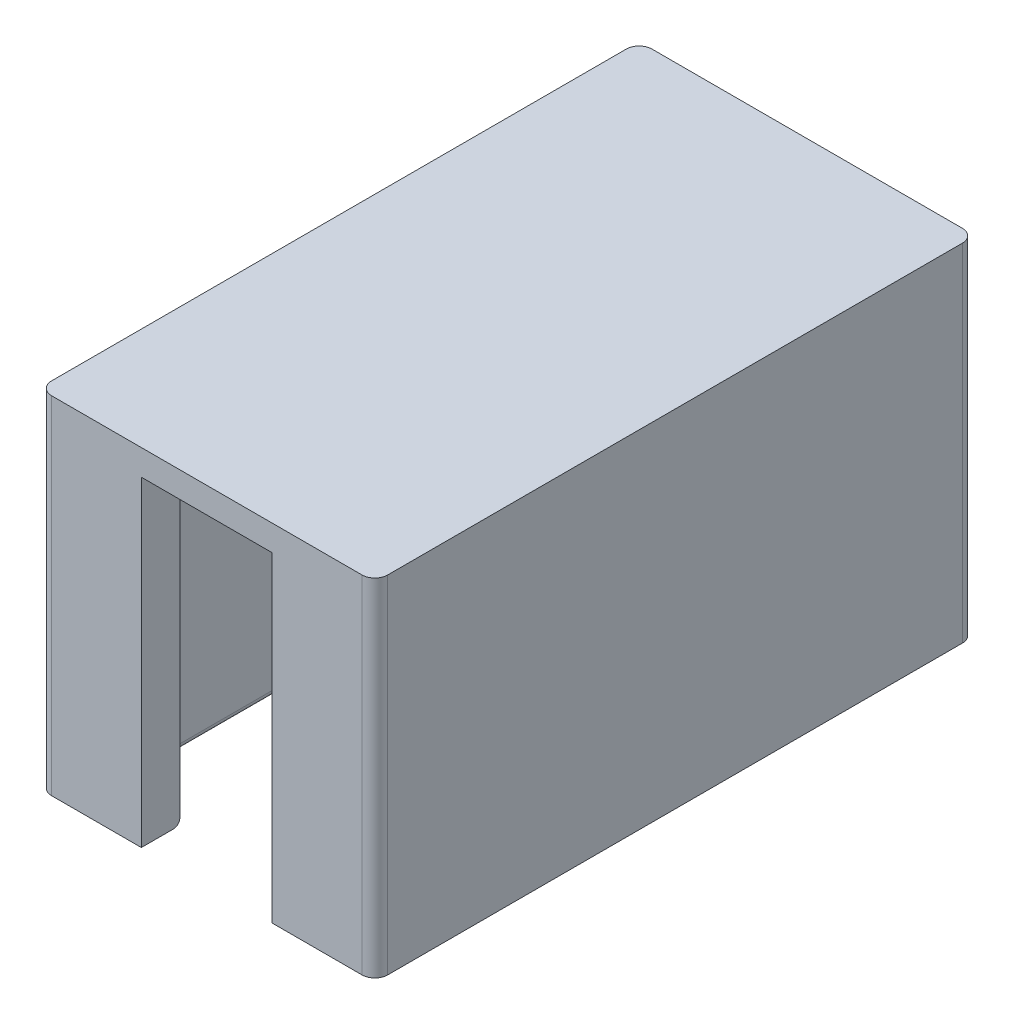
from build123d import *

# Parameters (mm, degrees)
SKETCH1_W           = 26.2
SKETCH1_H           = 46.8
SKETCH1_W_2         = 20.2
SKETCH1_H_2         = 40.8
BOSS_EXTRUDE1_DEPTH = 25
SKETCH3_W           = 10.2
SKETCH3_H           = 25
CUT_EXTRUDE1_DEPTH  = 10
FILLET1_R           = 0.5
SKETCH4_W           = 26.2
SKETCH4_H           = 46.8
BOSS_EXTRUDE2_DEPTH = 2
FILLET2_R           = 1


with BuildPart() as part:
    # Sketch1 → Boss-Extrude1 (new body)
    with BuildSketch(Plane(origin=(0, 0, 0), x_dir=(1, 0, 0), z_dir=(0, 1, 0))):
        with Locations((13.1, 23.4)):
            Rectangle(SKETCH1_W, SKETCH1_H)
        with Locations((13.1, 23.4)):
            Rectangle(SKETCH1_W_2, SKETCH1_H_2, mode=Mode.SUBTRACT)
    extrude(amount=BOSS_EXTRUDE1_DEPTH)

    # Sketch3 → Cut-Extrude1 (cut)
    with BuildSketch(Plane.XY):
        with Locations((13.1, 12.5)):
            Rectangle(SKETCH3_W, SKETCH3_H)
    extrude(amount=-CUT_EXTRUDE1_DEPTH, mode=Mode.SUBTRACT)

    # Fillet1
    fillet1_edges = [part.edges().sort_by_distance(p)[0] for p in [
        (3, 0, -23.4),
        (5.5, 0, -3),
        (23.2, 0, -23.4),
        (13.1, 0, -43.8),
        (3, 25, -23.4),
        (5.5, 25, -3),
        (23.2, 25, -23.4),
        (13.1, 25, -43.8),
        (20.7, 0, -3),
        (20.7, 25, -3),
    ]]
    fillet(fillet1_edges, radius=FILLET1_R)

    # Sketch4 → Boss-Extrude2 (add)
    with BuildSketch(Plane(origin=(0, 25, 0), x_dir=(1, 0, 0), z_dir=(0, 1, 0))):
        with Locations((13.1, 23.4)):
            Rectangle(SKETCH4_W, SKETCH4_H)
    extrude(amount=BOSS_EXTRUDE2_DEPTH)

    # Fillet2
    fillet2_edges = [part.edges().sort_by_distance(p)[0] for p in [
        (0, 13.5, -46.8),
        (26.2, 13.5, -46.8),
        (26.2, 13.5, 0),
        (0, 13.5, 0),
    ]]
    fillet(fillet2_edges, radius=FILLET2_R)


solid = part.part
